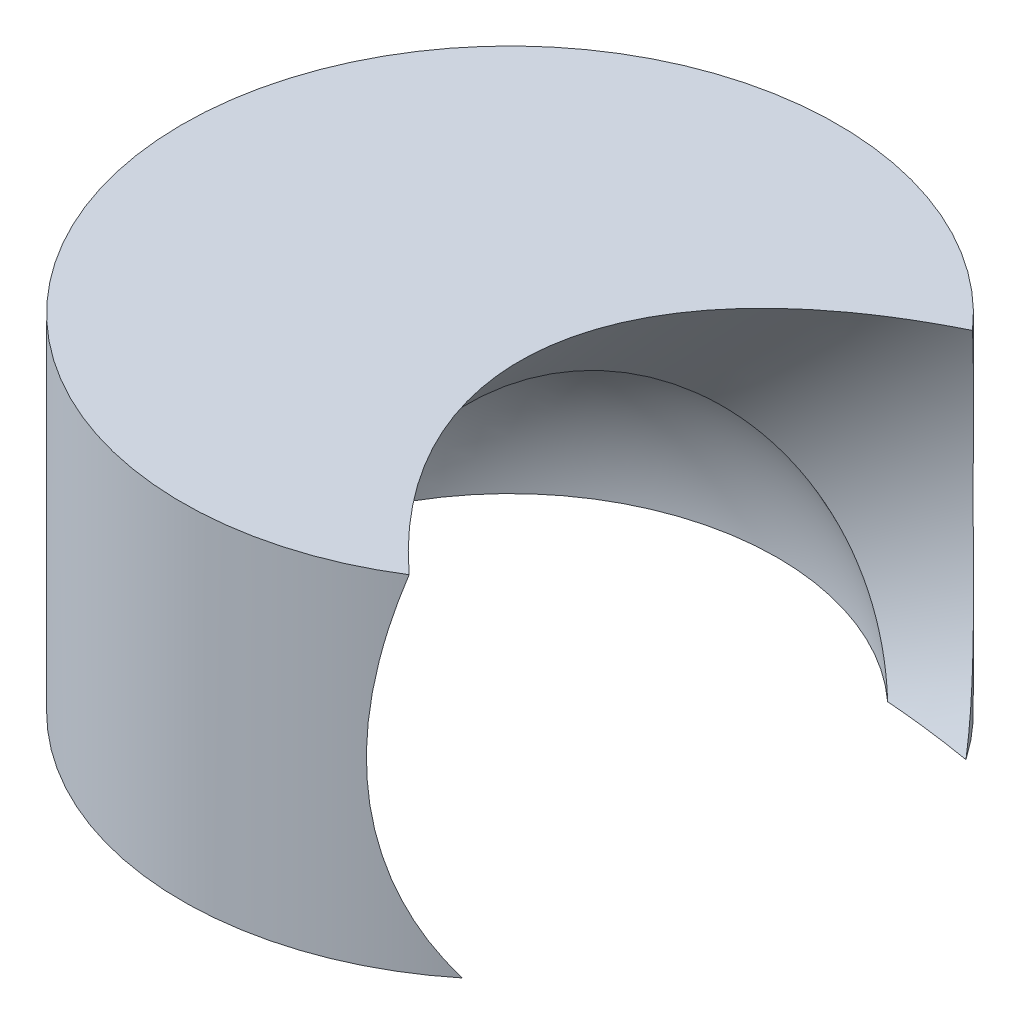
from build123d import *

# Parameters (mm, degrees)
KEYED_BACK_DEPTH   = 0.7
CUP_BLANK_SKETCH_R = 3.8
CUP_BLANK_DEPTH    = 3.3


with BuildPart() as part:
    # Keyed Back Sketch → Keyed Back (new body)
    with BuildSketch(Plane(origin=(0, -97, 0), x_dir=(-1, 0, 0), z_dir=(0, -1, 0))):
        with BuildLine():
            Line((79.27241336, 17.332380758), (79.27241336, 12.667619242))
            ThreePointArc((79.27241336, 12.667619242), (86.07241336, 15), (79.27241336, 17.332380758))
        make_face()
    extrude(amount=KEYED_BACK_DEPTH)

    # Cup Blank Sketch → Cup Blank (add)
    with BuildSketch(Plane(origin=(0, -97.7, 0), x_dir=(-1, 0, 0), z_dir=(0, -1, 0))):
        with Locations(Location((82.27241336, 15, 0), (0, 0, 217.863646362))):
            Circle(CUP_BLANK_SKETCH_R)
    extrude(amount=CUP_BLANK_DEPTH)

    # Spherical Bearing Seat profile → Spherical Bearing Seat (revolve, cut)
    with BuildSketch(Plane(origin=(0, -101, 0), x_dir=(-1, 0, 0), z_dir=(0, -1, 0))):
        with BuildLine():
            Line((82.27241336, 11.9), (82.27241336, 18.1))
            ThreePointArc((82.27241336, 18.1), (79.17241336, 15), (82.27241336, 11.9))
        make_face()
    revolve(axis=Axis((-82.27241336, -101, -25), (0, 0, 1)), mode=Mode.SUBTRACT)

    # Articulation Throat Sketch → Articulation Throat (revolve, cut)
    with BuildSketch(Plane(origin=(21.848129609, -32.292361412, -7.122138515), x_dir=(-0.8343429620590533, -0.5383086561091639, -0.11872494439026368), z_dir=(0.551245699903886, -0.8147619813060818, -0.17969722356136372))):
        Polygon((124.793457491, -7.104979762), (124.793457491, -4.804979762), (101.793457491, 1.915020238), (101.793457491, -7.104979762), align=None)
    revolve(axis=Axis((-90.61584298, -106.383086561, -16.187249444), (0.8343429620590537, 0.5383086561091633, 0.11872494439026321)), mode=Mode.SUBTRACT)


solid = part.part
